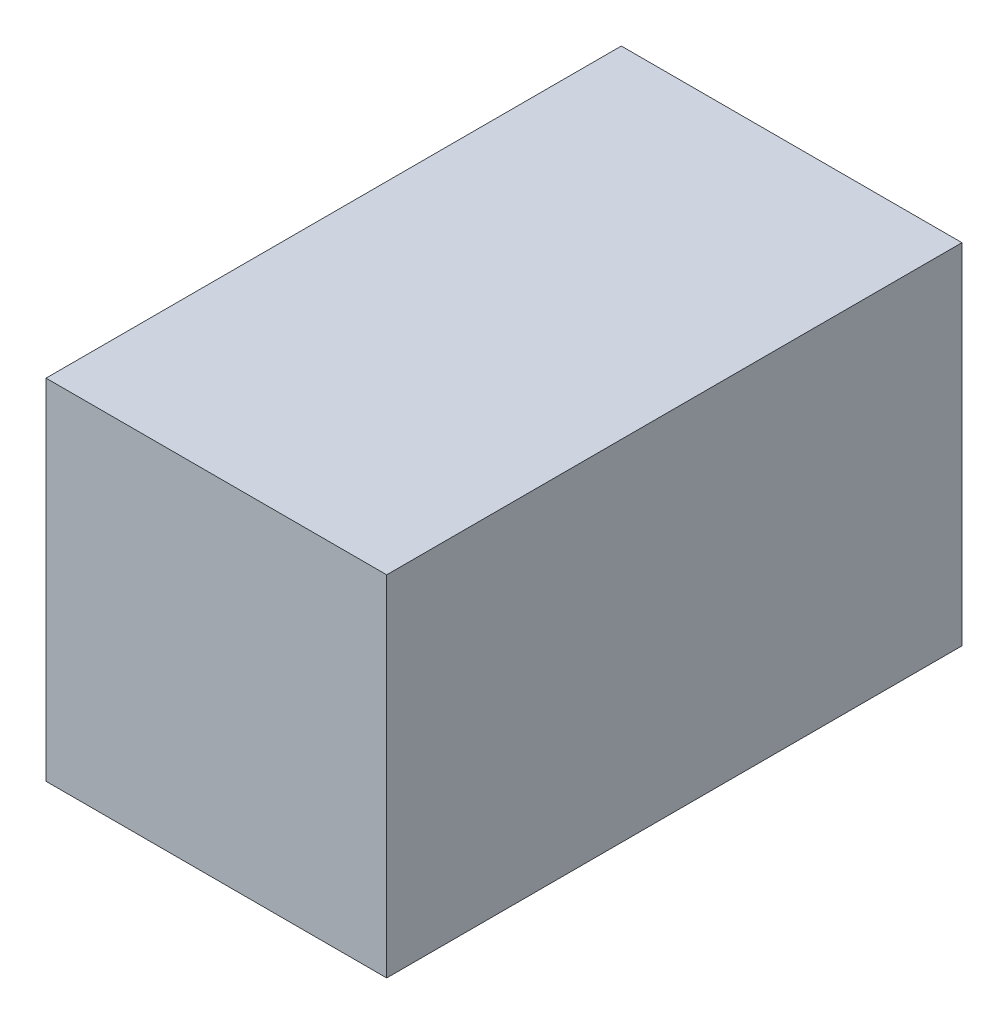
from build123d import *

# Parameters (mm, degrees)
SKETCH1_W               = 7.112
SKETCH1_H               = 7.2900032
COMPONENT_OUTLINE_DEPTH = 12.010009


with BuildPart() as part:
    # Sketch1 → Component_Outline (new body)
    with BuildSketch(Plane.XY):
        with Locations((1.7018, -0.0254)):
            Rectangle(SKETCH1_W, SKETCH1_H)
    extrude(amount=COMPONENT_OUTLINE_DEPTH)


solid = part.part
